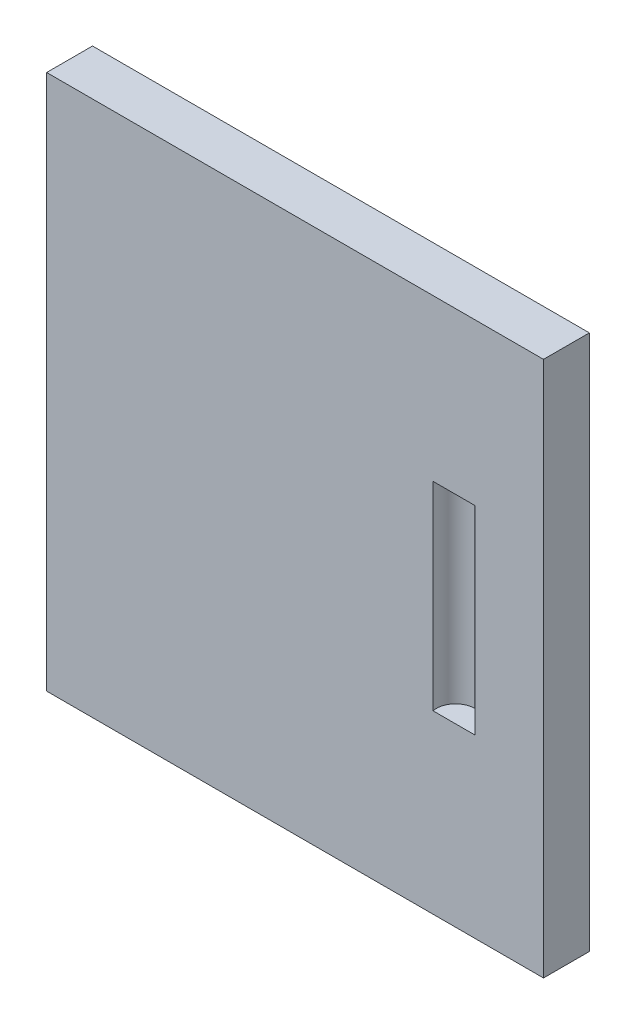
from build123d import *

# Parameters (mm, degrees)
SKETCH1_W               = 325
SKETCH1_H               = 400
BOSS_EXTRUDE1_DEPTH     = 15
SKETCH2_R               = 2.5
CUT_EXTRUDE1_DEPTH      = 10
SKETCH4_W               = 328.47257144
SKETCH4_H               = 49.54
CUT_EXTRUDE3_DEPTH      = 260.434481132
CUT_EXTRUDE4_DEPTH      = 65
MIRROR2_COPY_1_SKETCH_R = 2.5
MIRROR2_COPY_1_DEPTH    = 10
BOSS_EXTRUDE4_REACH     = 261.434
SKETCH6_R               = 2.5


with BuildPart() as part:
    # Sketch1 → Boss-Extrude1 (new, symmetric)
    with BuildSketch(Plane.XY):
        Rectangle(SKETCH1_W, SKETCH1_H)
    extrude(amount=BOSS_EXTRUDE1_DEPTH, both=True)

    # Sketch2 → Cut-Extrude1 (cut)
    with BuildSketch(Plane(origin=(0, 0, -15), x_dir=(-1, 0, 0), z_dir=(0, 0, -1))):
        with Locations((155, 135)):
            Circle(SKETCH2_R)
        with Locations((140, 115)):
            Circle(SKETCH2_R)
        with Locations((155, 95)):
            Circle(SKETCH2_R)
    cut_extrude1 = extrude(amount=-CUT_EXTRUDE1_DEPTH, mode=Mode.SUBTRACT)

    # Mirror1: Cut-Extrude1 across plane
    add(cut_extrude1.mirror(Plane.ZX), mode=Mode.SUBTRACT)

    # Sketch4 → Cut-Extrude3 (cut, through all)
    with BuildSketch(Plane.XY.offset(15)):
        with Locations((1.73628572, 175.23)):
            Rectangle(SKETCH4_W, SKETCH4_H)
    extrude(amount=-CUT_EXTRUDE3_DEPTH, mode=Mode.SUBTRACT)

    # Sketch5 → Cut-Extrude4 (cut, symmetric)
    with BuildSketch(Plane(origin=(0, -19.77, 0), x_dir=(1, 0, 0), z_dir=(0, 1, 0))):
        with BuildLine():
            Line((102.5, 0), (120.5, 0))
            ThreePointArc((120.5, 0), (125.115384615, -3.076923077), (124.050295858, -8.520710059))
            Line((124.050295858, -8.520710059), (111.375739645, -21.301775148))
            ThreePointArc((111.375739645, -21.301775148), (90.961538462, -17.307692308), (102.5, 0))
        make_face()
    extrude(amount=CUT_EXTRUDE4_DEPTH, both=True, mode=Mode.SUBTRACT)

    # Mirror2: Cut-Extrude1 across plane
    add(cut_extrude1.mirror(Plane.ZX.offset(-19.77)), mode=Mode.SUBTRACT)

    # Mirror2 copy 1 sketch → Mirror2 copy 1 (cut)
    with BuildSketch(Plane(origin=(0, -39.54, -15), x_dir=(-1, 0, 0), z_dir=(0, 0, -1))):
        with Locations((155, 135)):
            Circle(MIRROR2_COPY_1_SKETCH_R)
        with Locations((140, 115)):
            Circle(MIRROR2_COPY_1_SKETCH_R)
        with Locations((155, 95)):
            Circle(MIRROR2_COPY_1_SKETCH_R)
    extrude(amount=-MIRROR2_COPY_1_DEPTH, mode=Mode.SUBTRACT)

    # Sketch6 → Boss-Extrude4 (add, up to next)
    with BuildSketch(Plane(origin=(0, 0, -15), x_dir=(-1, 0, 0), z_dir=(0, 0, -1)), mode=Mode.PRIVATE) as boss_extrude4_sk1:
        with Locations((140, 115)):
            Circle(SKETCH6_R)
    boss_extrude4_tool1 = extrude(boss_extrude4_sk1.sketch, amount=-BOSS_EXTRUDE4_REACH, mode=Mode.PRIVATE) - part.part
    # Sketch6 → Boss-Extrude4 (add, up to next)
    with BuildSketch(Plane(origin=(0, 0, -15), x_dir=(-1, 0, 0), z_dir=(0, 0, -1)), mode=Mode.PRIVATE) as boss_extrude4_sk2:
        with Locations((155, 135)):
            Circle(SKETCH6_R)
    boss_extrude4_tool2 = extrude(boss_extrude4_sk2.sketch, amount=-BOSS_EXTRUDE4_REACH, mode=Mode.PRIVATE) - part.part
    # Sketch6 → Boss-Extrude4 (add, up to next)
    with BuildSketch(Plane(origin=(0, 0, -15), x_dir=(-1, 0, 0), z_dir=(0, 0, -1)), mode=Mode.PRIVATE) as boss_extrude4_sk3:
        with Locations((140, -154.54)):
            Circle(SKETCH6_R)
    boss_extrude4_tool3 = extrude(boss_extrude4_sk3.sketch, amount=-BOSS_EXTRUDE4_REACH, mode=Mode.PRIVATE) - part.part
    # Sketch6 → Boss-Extrude4 (add, up to next)
    with BuildSketch(Plane(origin=(0, 0, -15), x_dir=(-1, 0, 0), z_dir=(0, 0, -1)), mode=Mode.PRIVATE) as boss_extrude4_sk4:
        with Locations((155, -174.54)):
            Circle(SKETCH6_R)
    boss_extrude4_tool4 = extrude(boss_extrude4_sk4.sketch, amount=-BOSS_EXTRUDE4_REACH, mode=Mode.PRIVATE) - part.part
    add(boss_extrude4_tool1.solids().sort_by_distance((-140, 115, -15))[0])
    add(boss_extrude4_tool2.solids().sort_by_distance((-155, 135, -15))[0])
    add(boss_extrude4_tool3.solids().sort_by_distance((-140, -154.54, -15))[0])
    add(boss_extrude4_tool4.solids().sort_by_distance((-155, -174.54, -15))[0])


solid = part.part
